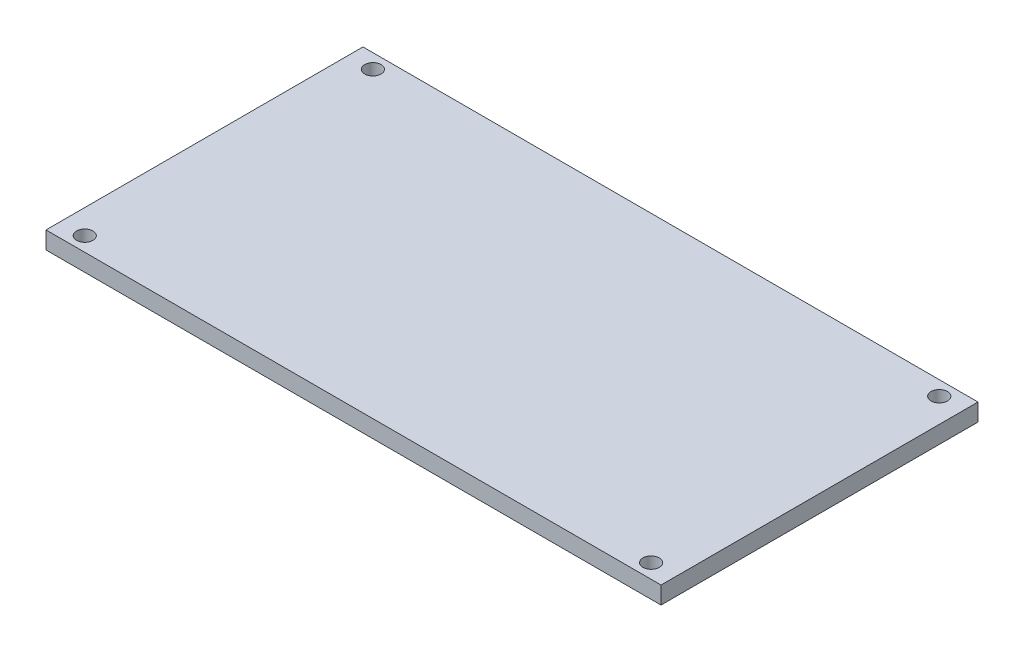
from build123d import *

# Parameters (mm, degrees)
SKETCH1_W      = 123.8
SKETCH1_H      = 63.8
SKETCH1_R      = 1.65
EXTRUDE1_DEPTH = 3.5


with BuildPart() as part:
    # Sketch1 → Extrude1 (new body)
    with BuildSketch(Plane(origin=(0, 0, 0), x_dir=(1, 0, 0), z_dir=(0, 1, 0))):
        Rectangle(SKETCH1_W, SKETCH1_H)
        with Locations(Location((-57, -29, 0), (0, 0, 270))):
            Circle(SKETCH1_R, mode=Mode.SUBTRACT)
        with Locations(Location((57, -29, 0), (0, 0, 270))):
            Circle(SKETCH1_R, mode=Mode.SUBTRACT)
        with Locations(Location((57, 29, 0), (0, 0, 270))):
            Circle(SKETCH1_R, mode=Mode.SUBTRACT)
        with Locations(Location((-57, 29, 0), (0, 0, 270))):
            Circle(SKETCH1_R, mode=Mode.SUBTRACT)
    extrude(amount=EXTRUDE1_DEPTH)


solid = part.part
